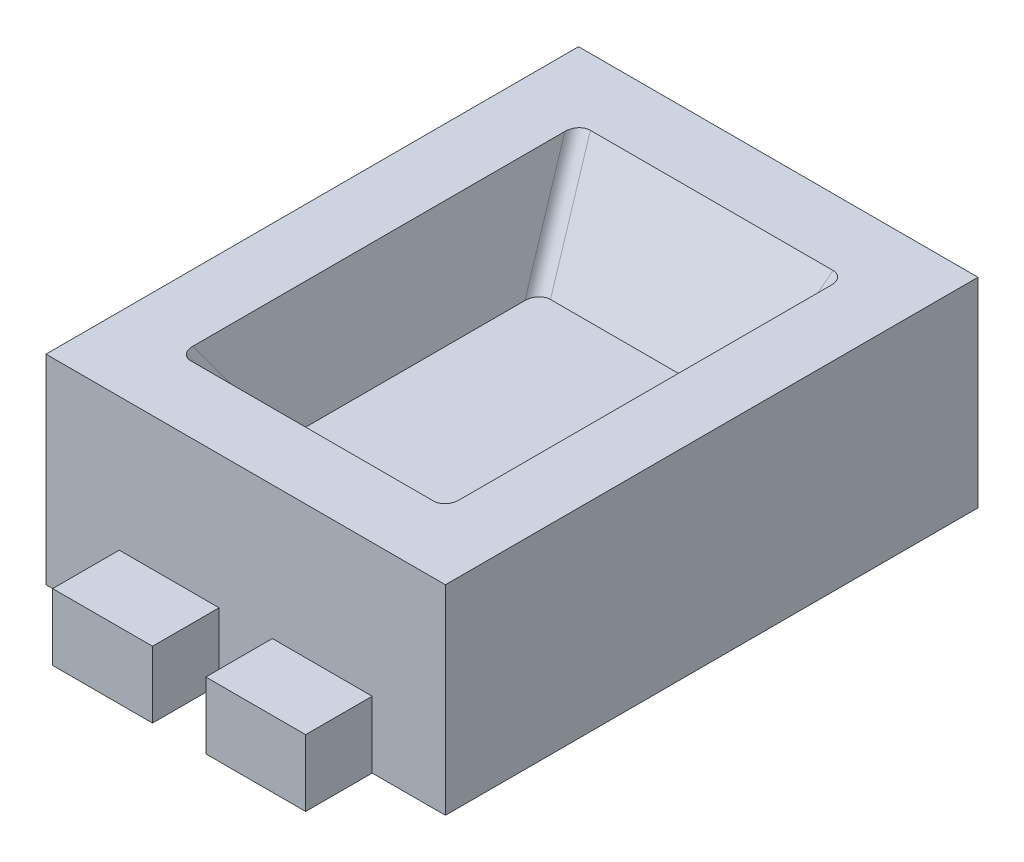
from build123d import *

# Parameters (mm, degrees)
SALIENTE_EXTRUIR1_DEPTH = 1.5
SALIENTE_EXTRUIR2_DEPTH = 1.5
REDONDEO2_R             = 0.1
CROQUIS3_W              = 0.75
CROQUIS3_H              = 0.5
SALIENTE_EXTRUIR3_DEPTH = 0.5


with BuildPart() as part:
    # Croquis1 → Saliente-Extruir1 (new, symmetric)
    with BuildSketch(Plane.XY):
        Polygon((-1.5, 0), (1.5, 0), (1.5, 1.5), (1, 1.5), (0.8, 0.75), (-0.8, 0.75), (-1, 1.5), (-1.5, 1.5), align=None)
    extrude(amount=SALIENTE_EXTRUIR1_DEPTH, both=True)

    # Croquis2 → Saliente-Extruir2 (add, symmetric)
    with BuildSketch(Plane(origin=(0, 0, 0), x_dir=(0, 0, -1), z_dir=(1, 0, 0))):
        Polygon((1, 0), (2, 0), (2, 1.5), (1.5, 1.5), (1, 0.75), align=None)
        Polygon((-1, 0.75), (-1, 0), (-2, 0), (-2, 1.5), (-1.5, 1.5), align=None)
    extrude(amount=SALIENTE_EXTRUIR2_DEPTH, both=True)

    # Redondeo2
    redondeo2_edges = [part.edges().sort_by_distance(p)[0] for p in [
        (0.9, 1.125, -1.25),
        (-0.9, 1.125, -1.25),
        (0.9, 1.125, 1.25),
        (-0.9, 1.125, 1.25),
    ]]
    fillet(redondeo2_edges, radius=REDONDEO2_R)

    # Croquis3 → Saliente-Extruir3 (add)
    with BuildSketch(Plane.XY.offset(2)):
        with Locations((-0.575, 0.25)):
            Rectangle(CROQUIS3_W, CROQUIS3_H)
        with Locations((0.575, 0.25)):
            Rectangle(CROQUIS3_W, CROQUIS3_H)
    saliente_extruir3 = extrude(amount=SALIENTE_EXTRUIR3_DEPTH)

    # Simetría1: Saliente-Extruir3 across plane
    add(saliente_extruir3.mirror(Plane.XY))


solid = part.part
